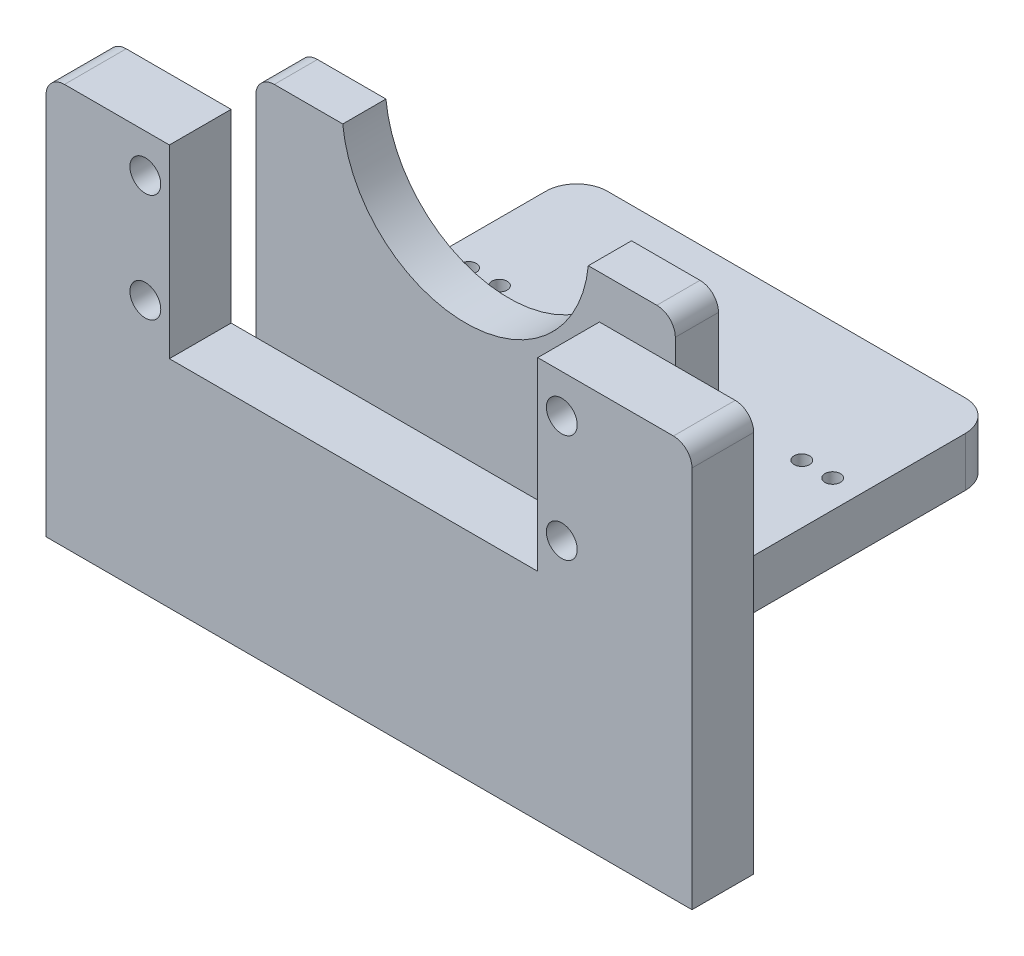
from build123d import *

# Parameters (mm, degrees)
CROQUIS1_R              = 2.5
SALIENTE_EXTRUIR2_DEPTH = 10
CROQUIS3_W              = 104.7
CROQUIS3_H              = 8
SALIENTE_EXTRUIR3_DEPTH = 45
CROQUIS4_W              = 104.7
CROQUIS4_H              = 7
SALIENTE_EXTRUIR4_DEPTH = 40
CROQUIS6_R              = 20
CORTAR_EXTRUIR1_DEPTH   = 92.797287028
REDONDEO2_R             = 3
CORTAR_EXTRUIR3_DEPTH   = 100.186815901
CROQUIS12_W             = 67.999748742
CROQUIS12_H             = 7
CORTAR_EXTRUIR4_DEPTH   = 104.841342675
REDONDEO5_R             = 5
CROQUIS13_W             = 67.999748742
CROQUIS13_H             = 8
CORTAR_EXTRUIR6_DEPTH   = 7
CROQUIS18_W             = 67.999748742
CROQUIS18_H             = 8
SALIENTE_EXTRUIR7_DEPTH = 45
CORTAR_EXTRUIR7_REACH   = 122.557
CROQUIS19_R             = 1.25
CROQUIS19_R_2           = 6.5
REDONDEO8_R             = 5
REDONDEO10_R            = 3


with BuildPart() as part:
    # Croquis1 → Saliente-Extruir2 (new body)
    with BuildSketch(Plane.XY):
        Polygon((74.222802753, 23.027181924), (49.222802753, 23.027181924), (49.222802753, -6.972818076), (-10.477197247, -6.972818076), (-10.477197247, 23.027181924), (-30.477197247, 23.027181924), (-30.477197247, -41.972818076), (74.222802753, -41.972818076), align=None)
        with Locations((-14.377197247, 16.777181924)):
            Circle(CROQUIS1_R, mode=Mode.SUBTRACT)
        with Locations((-14.377197247, -0.722818076)):
            Circle(CROQUIS1_R, mode=Mode.SUBTRACT)
        with Locations((53.122802753, 16.777181924)):
            Circle(CROQUIS1_R, mode=Mode.SUBTRACT)
        with Locations((53.122802753, -0.722818076)):
            Circle(CROQUIS1_R, mode=Mode.SUBTRACT)
    extrude(amount=SALIENTE_EXTRUIR2_DEPTH)

    # Croquis3 → Saliente-Extruir3 (add)
    with BuildSketch(Plane(origin=(0, 0, 0), x_dir=(-1, 0, 0), z_dir=(0, 0, -1))):
        with Locations((-21.872802753, -37.972818076)):
            Rectangle(CROQUIS3_W, CROQUIS3_H)
    extrude(amount=SALIENTE_EXTRUIR3_DEPTH)

    # Croquis4 → Saliente-Extruir4 (add)
    with BuildSketch(Plane(origin=(0, -33.972818076, 0), x_dir=(1, 0, 0), z_dir=(0, 1, 0))):
        with Locations((21.872802753, 27.5)):
            Rectangle(CROQUIS4_W, CROQUIS4_H)
    extrude(amount=SALIENTE_EXTRUIR4_DEPTH)

    # Croquis6 → Cortar-Extruir1 (cut, through all)
    with BuildSketch(Plane.XY.offset(-24)):
        with Locations((3.522802753, 8.027181924)):
            Circle(CROQUIS6_R)
    extrude(amount=-CORTAR_EXTRUIR1_DEPTH, mode=Mode.SUBTRACT)

    # Redondeo2
    redondeo2_edges = [part.edges().sort_by_distance(p)[0] for p in [
        (74.222802753, 23.027181924, 5),
        (-30.477197247, 23.027181924, 5),
    ]]
    fillet(redondeo2_edges, radius=REDONDEO2_R)

    # Croquis10 → Cortar-Extruir3 (cut, through all)
    with BuildSketch(Plane(origin=(0, 6.027181924, 0), x_dir=(1, 0, 0), z_dir=(0, 1, 0))):
        Polygon((74.222802753, 45), (37.522551495, 45), (37.522551495, 15.052232973), (74.222802753, 0), align=None)
    extrude(amount=-CORTAR_EXTRUIR3_DEPTH, mode=Mode.SUBTRACT)

    # Croquis12 → Cortar-Extruir4 (cut, through all)
    with BuildSketch(Plane(origin=(0, -33.972818076, 0), x_dir=(1, 0, 0), z_dir=(0, 1, 0))):
        with Locations((3.522677124, 41.5)):
            Rectangle(CROQUIS12_W, CROQUIS12_H)
    extrude(amount=-CORTAR_EXTRUIR4_DEPTH, mode=Mode.SUBTRACT)

    # Redondeo5
    redondeo5_edges = [part.edges().sort_by_distance(p)[0] for p in [
        (37.522551495, -37.972818076, -15.052232973),
    ]]
    fillet(redondeo5_edges, radius=REDONDEO5_R)

    # Croquis13 → Cortar-Extruir6 (cut)
    with BuildSketch(Plane(origin=(0, 0, -38), x_dir=(-1, 0, 0), z_dir=(0, 0, -1))):
        with Locations((-3.522677124, -37.972818076)):
            Rectangle(CROQUIS13_W, CROQUIS13_H)
    extrude(amount=-CORTAR_EXTRUIR6_DEPTH, mode=Mode.SUBTRACT)

    # Croquis18 → Saliente-Extruir7 (add)
    with BuildSketch(Plane(origin=(0, 0, -31), x_dir=(-1, 0, 0), z_dir=(0, 0, -1))):
        with Locations((-3.522677124, -37.972818076)):
            Rectangle(CROQUIS18_W, CROQUIS18_H)
    extrude(amount=SALIENTE_EXTRUIR7_DEPTH)

    # Croquis19 → Cortar-Extruir7 (cut, up to next)
    with BuildSketch(Plane(origin=(0, -33.972818076, 0), x_dir=(1, 0, 0), z_dir=(0, 1, 0)), mode=Mode.PRIVATE) as cortar_extruir7_sk1:
        with Locations(Location((-25.977197247, 54, 0), (0, 0, 270))):
            Circle(CROQUIS19_R)
    cortar_extruir7_tool1 = extrude(cortar_extruir7_sk1.sketch, amount=-CORTAR_EXTRUIR7_REACH, mode=Mode.PRIVATE) & part.part
    # Croquis19 → Cortar-Extruir7 (cut, up to next)
    with BuildSketch(Plane(origin=(0, -33.972818076, 0), x_dir=(1, 0, 0), z_dir=(0, 1, 0)), mode=Mode.PRIVATE) as cortar_extruir7_sk2:
        with Locations((33.022802753, 54)):
            Circle(CROQUIS19_R)
    cortar_extruir7_tool2 = extrude(cortar_extruir7_sk2.sketch, amount=-CORTAR_EXTRUIR7_REACH, mode=Mode.PRIVATE) & part.part
    # Croquis19 → Cortar-Extruir7 (cut, up to next)
    with BuildSketch(Plane(origin=(0, -33.972818076, 0), x_dir=(1, 0, 0), z_dir=(0, 1, 0)), mode=Mode.PRIVATE) as cortar_extruir7_sk3:
        with Locations(Location((-20.977197247, 54, 0), (0, 0, 270))):
            Circle(CROQUIS19_R)
    cortar_extruir7_tool3 = extrude(cortar_extruir7_sk3.sketch, amount=-CORTAR_EXTRUIR7_REACH, mode=Mode.PRIVATE) & part.part
    # Croquis19 → Cortar-Extruir7 (cut, up to next)
    with BuildSketch(Plane(origin=(0, -33.972818076, 0), x_dir=(1, 0, 0), z_dir=(0, 1, 0)), mode=Mode.PRIVATE) as cortar_extruir7_sk4:
        with Locations((28.022802753, 54)):
            Circle(CROQUIS19_R)
    cortar_extruir7_tool4 = extrude(cortar_extruir7_sk4.sketch, amount=-CORTAR_EXTRUIR7_REACH, mode=Mode.PRIVATE) & part.part
    # Croquis19 → Cortar-Extruir7 (cut, up to next)
    with BuildSketch(Plane(origin=(0, -33.972818076, 0), x_dir=(1, 0, 0), z_dir=(0, 1, 0)), mode=Mode.PRIVATE) as cortar_extruir7_sk5:
        with Locations(Location((3.522802753, 54, 0), (0, 0, 270))):
            Circle(CROQUIS19_R_2)
    cortar_extruir7_tool5 = extrude(cortar_extruir7_sk5.sketch, amount=-CORTAR_EXTRUIR7_REACH, mode=Mode.PRIVATE) & part.part
    add(cortar_extruir7_tool1.solids().sort_by_distance((-25.977197, -33.972818, -54))[0], mode=Mode.SUBTRACT)
    add(cortar_extruir7_tool2.solids().sort_by_distance((33.022803, -33.972818, -54))[0], mode=Mode.SUBTRACT)
    add(cortar_extruir7_tool3.solids().sort_by_distance((-20.977197, -33.972818, -54))[0], mode=Mode.SUBTRACT)
    add(cortar_extruir7_tool4.solids().sort_by_distance((28.022803, -33.972818, -54))[0], mode=Mode.SUBTRACT)
    add(cortar_extruir7_tool5.solids().sort_by_distance((3.522803, -33.972818, -54))[0], mode=Mode.SUBTRACT)

    # Redondeo8
    redondeo8_edges = [part.edges().sort_by_distance(p)[0] for p in [
        (37.522551495, -37.972818076, -76),
        (-30.477197247, -37.972818076, -76),
    ]]
    fillet(redondeo8_edges, radius=REDONDEO8_R)

    # Redondeo10
    redondeo10_edges = [part.edges().sort_by_distance(p)[0] for p in [
        (-30.477197247, 6.027181924, -27.5),
        (37.522551495, 6.027181924, -27.5),
    ]]
    fillet(redondeo10_edges, radius=REDONDEO10_R)


solid = part.part
